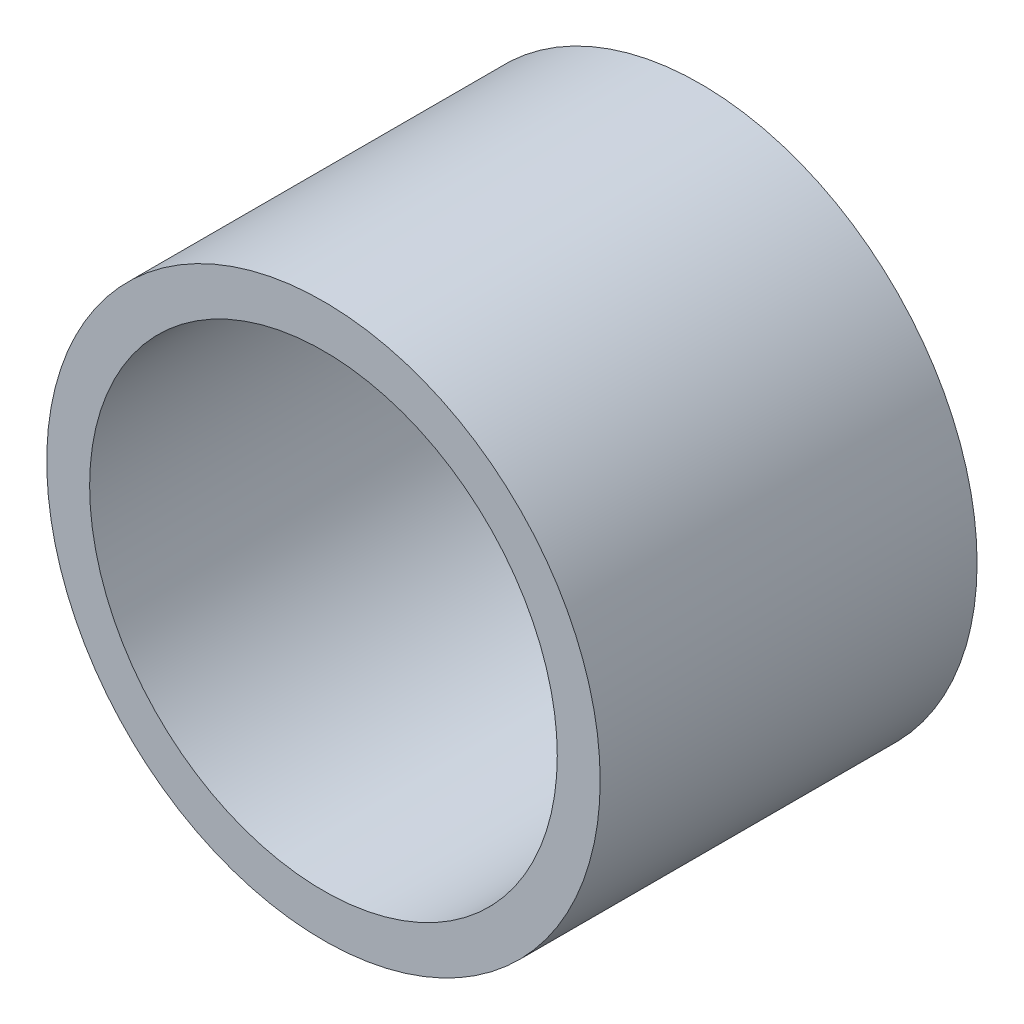
from build123d import *

# Parameters (mm, degrees)
SKETCH1_R           = 50
SKETCH1_R_2         = 42.25
BOSS_EXTRUDE1_DEPTH = 68.1


with BuildPart() as part:
    # Sketch1 → Boss-Extrude1 (new body)
    with BuildSketch(Plane.XY):
        Circle(SKETCH1_R)
        Circle(SKETCH1_R_2, mode=Mode.SUBTRACT)
    extrude(amount=BOSS_EXTRUDE1_DEPTH)


solid = part.part
